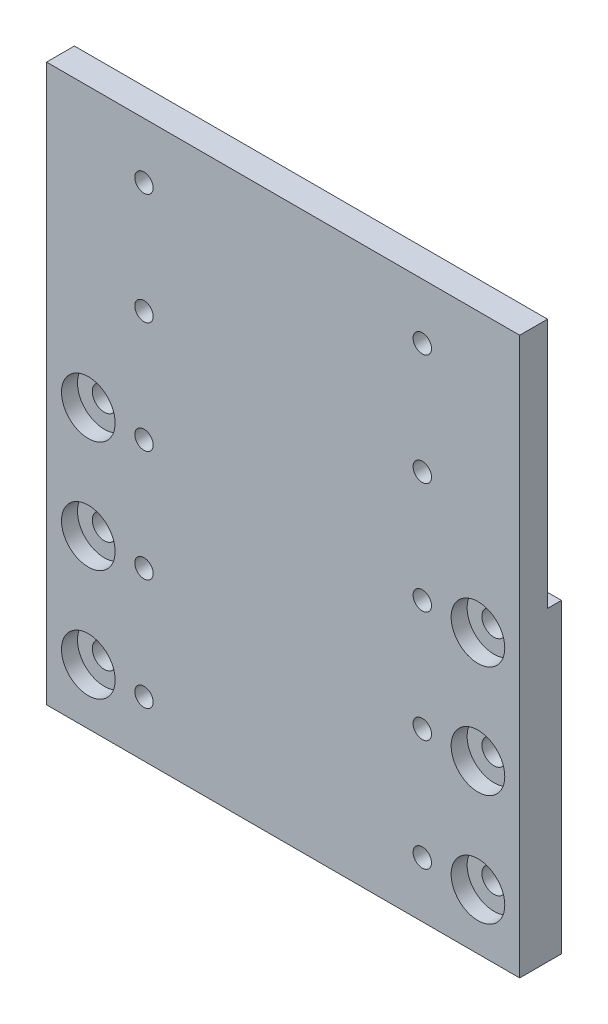
from build123d import *

# Parameters (mm, degrees)
SKETCH1_W                                    = 107.95
SKETCH1_H                                    = 127
EXTRUDE1_DEPTH                               = 9.525
CBORE_FOR_M5_HEX_HEAD_CAP_SCREW2_D           = 5.5
CBORE_FOR_M5_HEX_HEAD_CAP_SCREW2_CBORE_D     = 12.24
CBORE_FOR_M5_HEX_HEAD_CAP_SCREW2_CBORE_DEPTH = 3.65
LPATTERN5_COUNT                              = 3
LPATTERN5_PITCH                              = 25.4
LPATTERN6_COUNT                              = 2
LPATTERN6_PITCH                              = 88.9
LPATTERN6_COPY_1_D                           = 5.5
LPATTERN6_COPY_1_CBORE_D                     = 12.24
LPATTERN6_COPY_1_CBORE_DEPTH                 = 3.65
LPATTERN6_COPY_2_D                           = 5.5
LPATTERN6_COPY_2_CBORE_D                     = 12.24
LPATTERN6_COPY_2_CBORE_DEPTH                 = 3.65
M5X0_8_TAPPED_HOLE1_D                        = 4.2
LPATTERN7_COUNT                              = 5
LPATTERN7_PITCH                              = 25.4
LPATTERN8_COUNT                              = 2
LPATTERN8_PITCH                              = 63.5
LPATTERN8_COPY_1_D                           = 4.2
LPATTERN8_COPY_2_D                           = 4.2
LPATTERN8_COPY_3_D                           = 4.2
LPATTERN8_COPY_4_D                           = 4.2
SKETCH16_W                                   = 107.95
SKETCH16_H                                   = 57.15
EXTRUDE2_DEPTH                               = 3.175


with BuildPart() as part:
    # Sketch1 → Extrude1 (new body)
    with BuildSketch(Plane.XY):
        Rectangle(SKETCH1_W, SKETCH1_H)
    extrude(amount=EXTRUDE1_DEPTH)

    # CBORE for M5 Hex Head Cap Screw2 (through all)
    with Locations(Plane(origin=(-44.45, -50.8, 9.525), x_dir=(1, 0, 0), z_dir=(0, 0, 1))):
        with Locations((0, 0)):
            cbore_for_m5_hex_head_cap_screw2 = CounterBoreHole(CBORE_FOR_M5_HEX_HEAD_CAP_SCREW2_D / 2, CBORE_FOR_M5_HEX_HEAD_CAP_SCREW2_CBORE_D / 2, CBORE_FOR_M5_HEX_HEAD_CAP_SCREW2_CBORE_DEPTH)

    # LPattern5: CBORE for M5 Hex Head Cap Screw2 ×3
    with Locations(*[(0, i * LPATTERN5_PITCH, 0) for i in range(1, LPATTERN5_COUNT)]):
        add(cbore_for_m5_hex_head_cap_screw2, mode=Mode.SUBTRACT)

    # LPattern6: CBORE for M5 Hex Head Cap Screw2 ×2
    with Locations(*[(i * LPATTERN6_PITCH, 0, 0) for i in range(1, LPATTERN6_COUNT)]):
        add(cbore_for_m5_hex_head_cap_screw2, mode=Mode.SUBTRACT)

    # LPattern6 copy 1 (through all)
    with Locations(Plane(origin=(44.45, -25.4, 9.525), x_dir=(1, 0, 0), z_dir=(0, 0, 1))):
        with Locations((0, 0)):
            CounterBoreHole(LPATTERN6_COPY_1_D / 2, LPATTERN6_COPY_1_CBORE_D / 2, LPATTERN6_COPY_1_CBORE_DEPTH)

    # LPattern6 copy 2 (through all)
    with Locations(Plane(origin=(44.45, 0, 9.525), x_dir=(1, 0, 0), z_dir=(0, 0, 1))):
        with Locations((0, 0)):
            CounterBoreHole(LPATTERN6_COPY_2_D / 2, LPATTERN6_COPY_2_CBORE_D / 2, LPATTERN6_COPY_2_CBORE_DEPTH)

    # M5x0.8 Tapped Hole1 (through all)
    with Locations(Plane(origin=(-31.75, -50.8, 9.525), x_dir=(1, 0, 0), z_dir=(0, 0, 1))):
        with Locations((0, 0)):
            m5x0_8_tapped_hole1 = Hole(M5X0_8_TAPPED_HOLE1_D / 2)

    # LPattern7: M5x0.8 Tapped Hole1 ×5
    with Locations(*[(0, i * LPATTERN7_PITCH, 0) for i in range(1, LPATTERN7_COUNT)]):
        add(m5x0_8_tapped_hole1, mode=Mode.SUBTRACT)

    # LPattern8: M5x0.8 Tapped Hole1 ×2
    with Locations(*[(i * LPATTERN8_PITCH, 0, 0) for i in range(1, LPATTERN8_COUNT)]):
        add(m5x0_8_tapped_hole1, mode=Mode.SUBTRACT)

    # LPattern8 copy 1 (through all)
    with Locations(Plane(origin=(31.75, -25.4, 9.525), x_dir=(1, 0, 0), z_dir=(0, 0, 1))):
        with Locations((0, 0)):
            Hole(LPATTERN8_COPY_1_D / 2)

    # LPattern8 copy 2 (through all)
    with Locations(Plane(origin=(31.75, 0, 9.525), x_dir=(1, 0, 0), z_dir=(0, 0, 1))):
        with Locations((0, 0)):
            Hole(LPATTERN8_COPY_2_D / 2)

    # LPattern8 copy 3 (through all)
    with Locations(Plane(origin=(31.75, 25.4, 9.525), x_dir=(1, 0, 0), z_dir=(0, 0, 1))):
        with Locations((0, 0)):
            Hole(LPATTERN8_COPY_3_D / 2)

    # LPattern8 copy 4 (through all)
    with Locations(Plane(origin=(31.75, 50.8, 9.525), x_dir=(1, 0, 0), z_dir=(0, 0, 1))):
        with Locations((0, 0)):
            Hole(LPATTERN8_COPY_4_D / 2)

    # Sketch16 → Extrude2 (cut)
    with BuildSketch(Plane(origin=(0, 0, 0), x_dir=(-1, 0, 0), z_dir=(0, 0, -1))):
        with Locations((0, 34.925)):
            Rectangle(SKETCH16_W, SKETCH16_H)
    extrude(amount=-EXTRUDE2_DEPTH, mode=Mode.SUBTRACT)


solid = part.part
